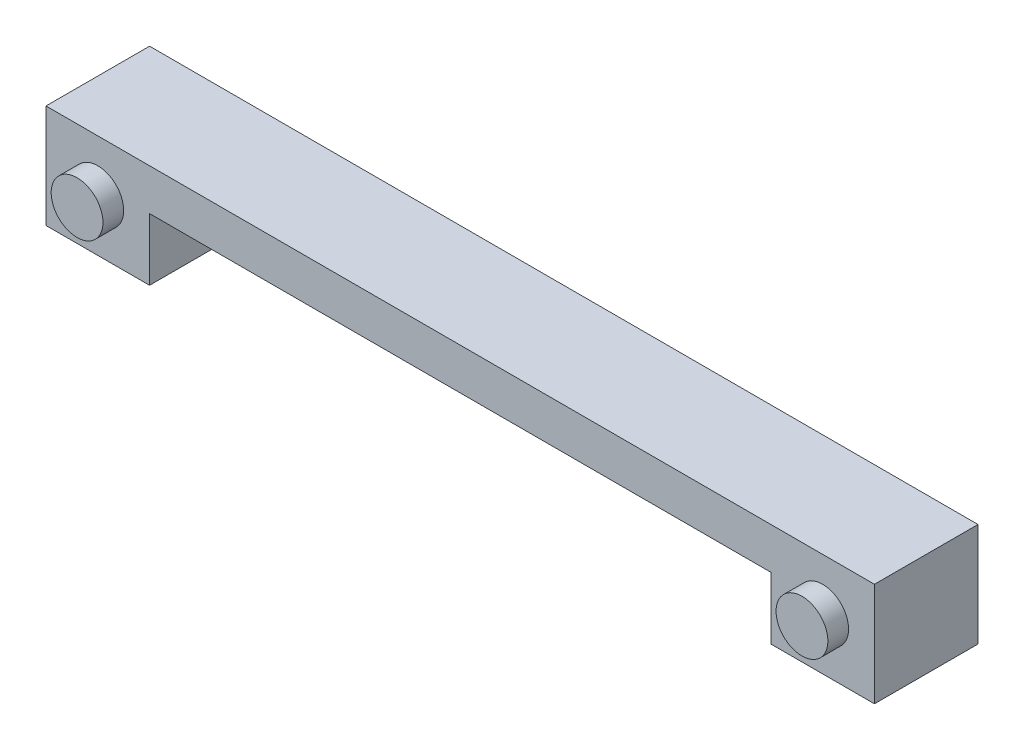
from build123d import *

# Parameters (mm, degrees)
SKETCH1_W           = 6.35
SKETCH1_H           = 6.35
SKETCH1_W_2         = 19.05
SKETCH1_H_2         = 2.54
BOSS_EXTRUDE1_DEPTH = 6.35
SKETCH2_R           = 1.5875
BOSS_EXTRUDE2_DEPTH = 1.27


with BuildPart() as part:
    # Sketch1 → Boss-Extrude1 (new body)
    with BuildSketch(Plane.XY):
        with Locations((3.175, 3.175)):
            Rectangle(SKETCH1_W, SKETCH1_H)
        with Locations((15.875, 5.08)):
            Rectangle(SKETCH1_W_2, SKETCH1_H_2)
    boss_extrude1 = extrude(amount=BOSS_EXTRUDE1_DEPTH)

    # Sketch2 → Boss-Extrude2 (add)
    with BuildSketch(Plane.XY.offset(6.35)):
        with Locations((3.175, 3.175)):
            Circle(SKETCH2_R)
    boss_extrude2 = extrude(amount=BOSS_EXTRUDE2_DEPTH)

    # Mirror1: Boss-Extrude1, Boss-Extrude2 across plane
    add(boss_extrude1.mirror(Plane(origin=(25.4, 0, 6.35), x_dir=(0, 0, 1), z_dir=(1, 0, 0))))
    add(boss_extrude2.mirror(Plane(origin=(25.4, 0, 6.35), x_dir=(0, 0, 1), z_dir=(1, 0, 0))))


solid = part.part
